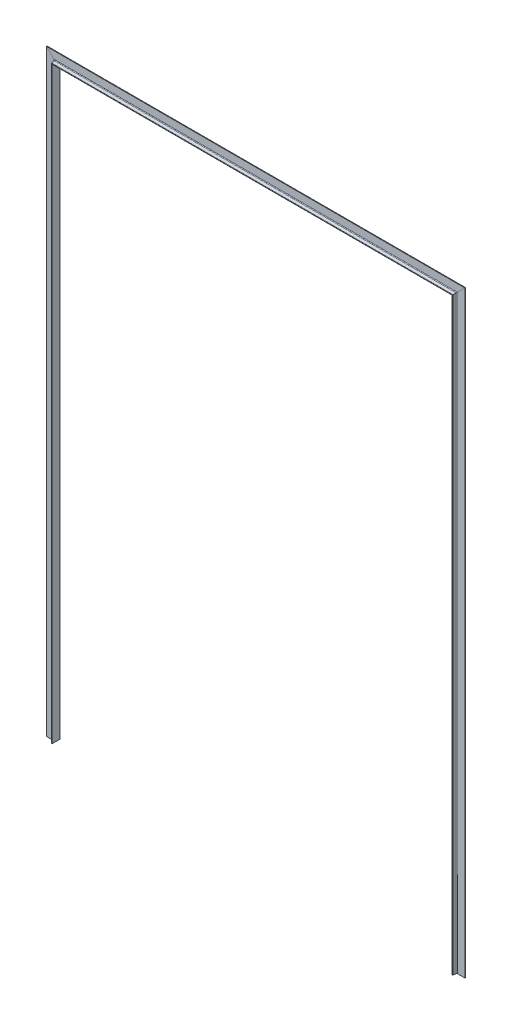
from build123d import *

# Parameters (mm, degrees)
ST_SECTION_ST6X17_5_2_DEPTH   = 10166.483526335
ST_SECTION_ST6X17_5_2_2_DEPTH = 7332.967052671
ST_SECTION_ST6X17_5_2_3_DEPTH = 10166.483526336


with BuildPart() as part:
    # Sketch12 → St section ST6X17.5(2) (new body)
    with BuildSketch(Plane.ZX):
        with BuildLine():
            Line((-64.4906, 152.4), (64.4906, 152.4))
            Line((64.4906, 152.4), (64.4906, 147.996286207))
            ThreePointArc((64.4906, 147.996286207), (63.226568979, 144.548546584), (60.033566439, 142.734871391))
            Line((60.033566439, 142.734871391), (14.986386201, 135.22646032))
            ThreePointArc((14.986386201, 135.22646032), (8.144237901, 131.340013477), (5.4356, 123.952))
            Line((5.4356, 123.952), (5.4356, 0))
            Line((5.4356, 0), (-5.4356, 0))
            Line((-5.4356, 0), (-5.4356, 123.952))
            ThreePointArc((-5.4356, 123.952), (-8.144237901, 131.340013477), (-14.986386201, 135.22646032))
            Line((-14.986386201, 135.22646032), (-60.033566439, 142.734871391))
            ThreePointArc((-60.033566439, 142.734871391), (-63.226568979, 144.548546584), (-64.4906, 147.996286207))
            Line((-64.4906, 147.996286207), (-64.4906, 152.4))
        make_face()
    extrude(amount=ST_SECTION_ST6X17_5_2_DEPTH)

    # St section ST6X17.5(2) mitre 1
    split(bisect_by=Plane(origin=(0, 10000, 0), x_dir=(0.707106781, -0.707106781, 0), z_dir=(-0.707106781, -0.707106781, 0)), keep=Keep.TOP)


with BuildPart() as body_2:
    # Sketch12 on segment 2 (carried to segment 2) → St section ST6X17.5_2 2 (new body)
    with BuildSketch(Plane(origin=(-166.483526335, 10000, 0), x_dir=(0, 0, 1), z_dir=(1, 0, 0))):
        with BuildLine():
            Line((-64.4906, 152.4), (64.4906, 152.4))
            Line((64.4906, 152.4), (64.4906, 147.996286207))
            ThreePointArc((64.4906, 147.996286207), (63.226568979, 144.548546584), (60.033566439, 142.734871391))
            Line((60.033566439, 142.734871391), (14.986386201, 135.22646032))
            ThreePointArc((14.986386201, 135.22646032), (8.144237901, 131.340013477), (5.4356, 123.952))
            Line((5.4356, 123.952), (5.4356, 0))
            Line((5.4356, 0), (-5.4356, 0))
            Line((-5.4356, 0), (-5.4356, 123.952))
            ThreePointArc((-5.4356, 123.952), (-8.144237901, 131.340013477), (-14.986386201, 135.22646032))
            Line((-14.986386201, 135.22646032), (-60.033566439, 142.734871391))
            ThreePointArc((-60.033566439, 142.734871391), (-63.226568979, 144.548546584), (-64.4906, 147.996286207))
            Line((-64.4906, 147.996286207), (-64.4906, 152.4))
        make_face()
    extrude(amount=ST_SECTION_ST6X17_5_2_2_DEPTH)

    # St section ST6X17.5_2 2 mitre 1
    split(bisect_by=Plane(origin=(0, 10000, 0), x_dir=(-0.707106781, 0.707106781, 0), z_dir=(0.707106781, 0.707106781, 0)), keep=Keep.TOP)

    # St section ST6X17.5_2 2 mitre 2
    split(bisect_by=Plane(origin=(7000, 10000, 0), x_dir=(-0.707106781, -0.707106781, 0), z_dir=(-0.707106781, 0.707106781, 0)), keep=Keep.TOP)


with BuildPart() as body_3:
    # Sketch12 on segment 3 (carried to segment 3) → St section ST6X17.5_2 3 (new body)
    with BuildSketch(Plane(origin=(7000, 10166.483526335, 0), x_dir=(0, 0, 1), z_dir=(0, -1, 0))):
        with BuildLine():
            Line((-64.4906, 152.4), (64.4906, 152.4))
            Line((64.4906, 152.4), (64.4906, 147.996286207))
            ThreePointArc((64.4906, 147.996286207), (63.226568979, 144.548546584), (60.033566439, 142.734871391))
            Line((60.033566439, 142.734871391), (14.986386201, 135.22646032))
            ThreePointArc((14.986386201, 135.22646032), (8.144237901, 131.340013477), (5.4356, 123.952))
            Line((5.4356, 123.952), (5.4356, 0))
            Line((5.4356, 0), (-5.4356, 0))
            Line((-5.4356, 0), (-5.4356, 123.952))
            ThreePointArc((-5.4356, 123.952), (-8.144237901, 131.340013477), (-14.986386201, 135.22646032))
            Line((-14.986386201, 135.22646032), (-60.033566439, 142.734871391))
            ThreePointArc((-60.033566439, 142.734871391), (-63.226568979, 144.548546584), (-64.4906, 147.996286207))
            Line((-64.4906, 147.996286207), (-64.4906, 152.4))
        make_face()
    extrude(amount=ST_SECTION_ST6X17_5_2_3_DEPTH)

    # St section ST6X17.5_2 3 mitre 1
    split(bisect_by=Plane(origin=(7000, 10000, 0), x_dir=(0.707106781, 0.707106781, 0), z_dir=(0.707106781, -0.707106781, 0)), keep=Keep.TOP)


solid = Compound([part.part, body_2.part, body_3.part])
